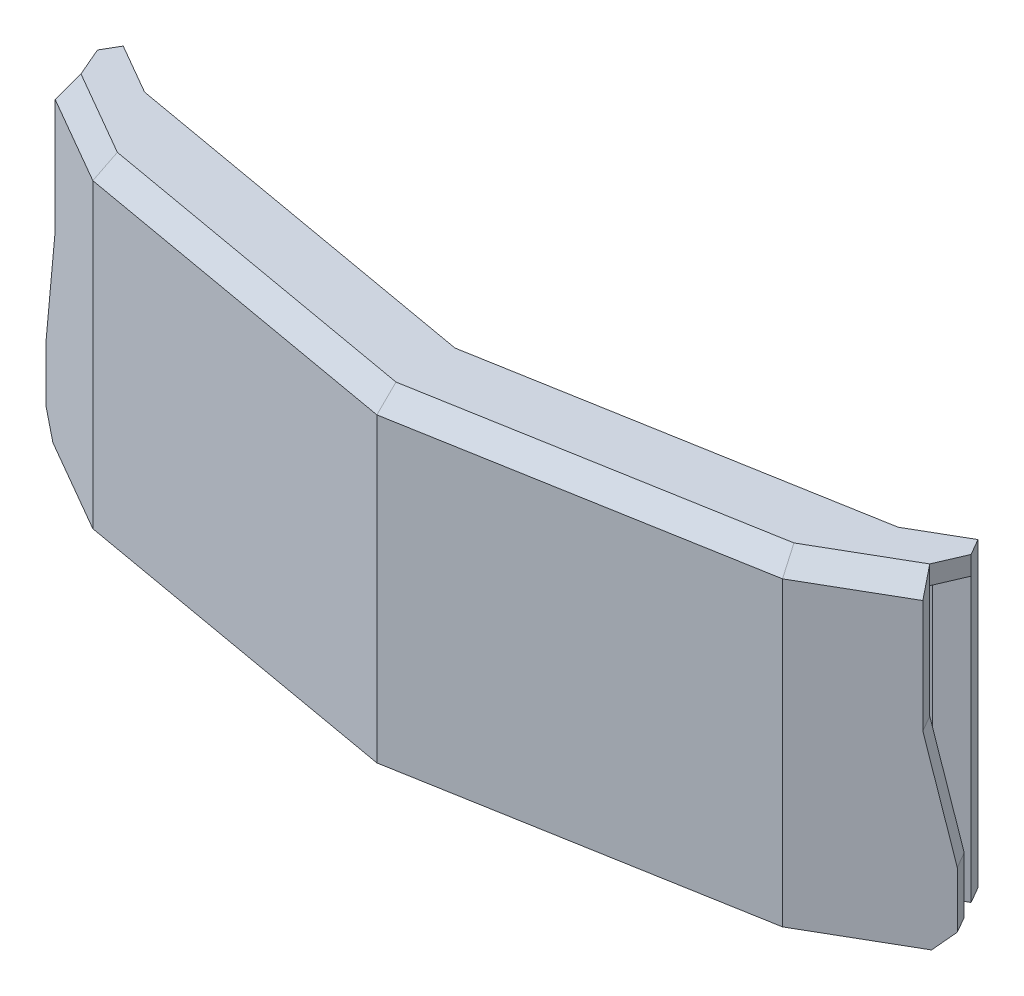
from build123d import *

# Parameters (mm, degrees)
BOSS_EXTRUDE2_DEPTH = 32
CUT_EXTRUDE2_DEPTH  = 2
CHAMFER3_SIZE       = 2
CUT_EXTRUDE3_DEPTH  = 2
BOSS_EXTRUDE4_DEPTH = 2
CHAMFER4_SIZE       = 2
CUT_EXTRUDE4_DEPTH  = 2
CUT_EXTRUDE5_DEPTH  = 30


with BuildPart() as part:
    # Sketch1 → Boss-Extrude2 (new body)
    with BuildSketch(Plane(origin=(0, 0, 0), x_dir=(1, 0, 0), z_dir=(0, 1, 0))):
        Polygon((-46.372280014218745, 14.680854952562456), (-42.04215299529653, 12.180854952562488), (-43.04215299529651, 10.448804144993609), (-47.372280014218724, 12.948804144993577), (-48.37228001421871, 11.216753337424702), (-36.60670775986293, 4.423897029202528), (1.0929e-13, -2.030853223771254), (36.60670775986312, 4.423897029202558), (48.37228001421891, 11.216753337424812), (47.37228001421898, 12.948804144993561), (43.04215299529678, 10.448804144993572), (42.04215299529679, 12.180854952562449), (46.37228001421899, 14.680854952562438), (45.372280014219, 16.412905760131313), (40, 13.31121844775995), (40, 8.692416294243028), (35.91211504919529, 6.332274817479665), (0, 0), (-35.91211504919526, 6.3322748174796235), (-40.00000000000001, 8.692416294243028), (-40.00000000000001, 13.311218447759854), (-45.37228001421887, 16.41290576013115), align=None)
    extrude(amount=BOSS_EXTRUDE2_DEPTH)

    # Sketch9 → Cut-Extrude2 (cut)
    with BuildSketch(Plane(origin=(6.236073334457828, 0, 10.801195855006485), x_dir=(-0.8660254037844402, 0, 0.4999999999999974), z_dir=(-0.4999999999999974, 0, -0.8660254037844402))):
        Polygon((-44.8209624184392, 20), (-47.50000000000022, 7.944330883818674), (-47.50000000000013, 32), (-44.8209624184392, 32), align=None)
    extrude(amount=-CUT_EXTRUDE2_DEPTH, mode=Mode.SUBTRACT)

    # Chamfer3
    chamfer3_edges = [part.edges().sort_by_distance(p)[0] for p in [
        (47.872280014218944, 0, -12.082778741209186),
        (-47.87228001421872, 0, -12.08277874120914),
    ]]
    chamfer(chamfer3_edges, length=CHAMFER3_SIZE)

    # Sketch8 → Cut-Extrude3 (cut)
    with BuildSketch(Plane(origin=(-6.236073334457578, 0, 10.801195855006183), x_dir=(-0.8660254037844388, 0, -0.49999999999999983), z_dir=(0.4999999999999998, 0, -0.8660254037844387))):
        Polygon((44.82096241843918, 32), (47.50000000000006, 32), (47.50000000000006, 7.944330883819361), (44.82096241843918, 20), align=None)
    extrude(amount=-CUT_EXTRUDE3_DEPTH, mode=Mode.SUBTRACT)

    # Sketch11 → Boss-Extrude4 (add)
    with BuildSketch(Plane(origin=(0, 32, 0), x_dir=(1, 0, 0), z_dir=(0, 1, 0))):
        Polygon((-46.37228001421867, 14.680854952562523), (-45.37228001421879, 16.4129057601312), (-40.00000000000001, 13.311218447759854), (-1.3184e-13, 6.258139219421286), (40, 13.31121844775995), (45.37228001421892, 16.412905760131267), (46.372280014218916, 14.680854952562392), (45.052165410893835, 11.609285354213014), (46.05216541089376, 9.87723454664427), (36.60670775986312, 4.423897029202558), (1.0929e-13, -2.030853223771254), (-36.60670775986293, 4.423897029202528), (-46.052165410893714, 9.877234546644353), (-45.0521654108937, 11.609285354213252), align=None)
    extrude(amount=BOSS_EXTRUDE4_DEPTH)

    # Chamfer4
    chamfer4_edges = [part.edges().sort_by_distance(p)[0] for p in [
        (18.303353879931613, 34, -1.1965219027156522),
        (-18.303353879931407, 34, -1.1965219027156366),
        (41.32943658537844, 34, -7.150565787923414),
        (-41.32943658537832, 34, -7.1505657879234406),
    ]]
    chamfer(chamfer4_edges, length=CHAMFER4_SIZE)

    # Sketch12 → Cut-Extrude4 (cut)
    with BuildSketch(Plane.XZ):
        Polygon((40, -8.692416294243028), (43.04215299529678, -10.448804144993572), (47.37228001421891, -12.948804144993517), (45.37228001421892, -16.412905760131267), (40, -13.31121844775995), align=None)
        Polygon((-47.37228001421867, -12.948804144993655), (-40.00000000000001, -8.692416294243028), (-40.00000000000001, -13.311218447759854), (-45.37228001421879, -16.4129057601312), align=None)
    extrude(amount=-CUT_EXTRUDE4_DEPTH, mode=Mode.SUBTRACT)

    # Sketch13 → Cut-Extrude5 (cut)
    with BuildSketch(Plane.XZ.offset(-2)):
        Polygon((43.04215299529678, -10.448804144993572), (42.04215299529679, -12.180854952562449), (41.54215299529678, -13.046880356346884), (43.27420380286566, -14.046880356346884), (44.774203802865564, -11.448804144993552), align=None)
        Polygon((-43.04215299529651, -10.448804144993609), (-42.04215299529653, -12.180854952562488), (-41.54215299529657, -13.046880356346884), (-43.27420380286547, -14.046880356346882), (-44.77420380286537, -11.448804144993701), align=None)
    extrude(amount=-CUT_EXTRUDE5_DEPTH, mode=Mode.SUBTRACT)


solid = part.part
